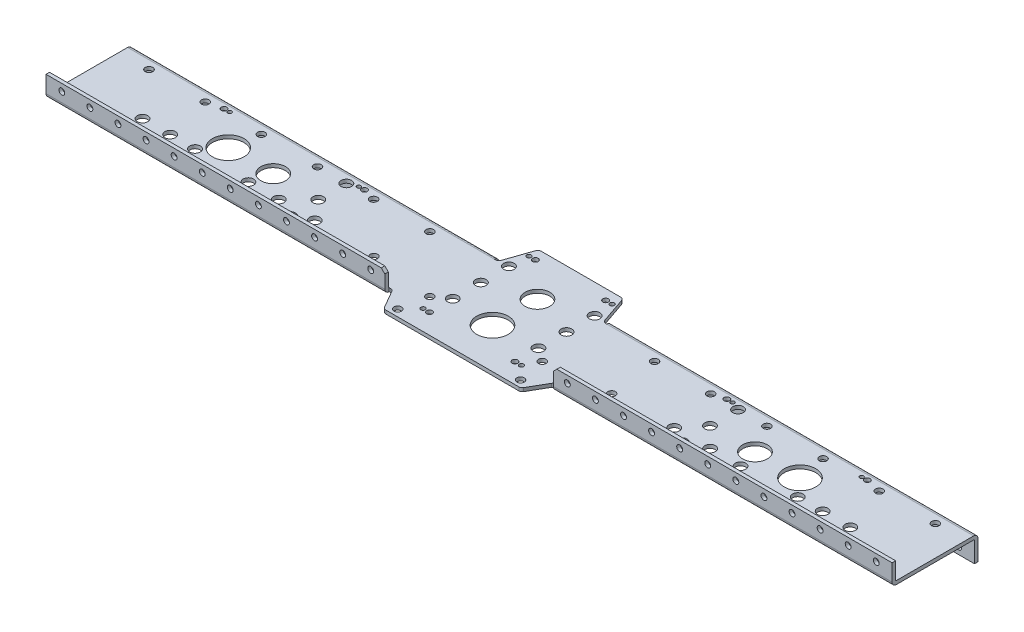
from build123d import *

# Parameters (mm, degrees)
SKETCH1_W                        = 355.6
SKETCH1_H                        = 77.724
BOSS_EXTRUDE1_DEPTH              = 22.225
SKETCH2_W                        = 74.549
SKETCH2_H                        = 19.05
CUT_EXTRUDE1_DEPTH               = 364.67400769
SKETCH3_W                        = 25.4
SKETCH3_H                        = 3.937
CUT_EXTRUDE2_DEPTH               = 817.364663535
SKETCH4_W                        = 330.2
SKETCH4_H                        = 3.175
BOSS_EXTRUDE2_DEPTH              = 15.875
SKETCH5_W                        = 69.85
SKETCH5_H                        = 3.175
BOSS_EXTRUDE3_DEPTH              = 457.2
SKETCH6_W                        = 330.2
SKETCH6_H                        = 3.175
BOSS_EXTRUDE4_DEPTH              = 3.937
SKETCH7_W                        = 330.2
SKETCH7_H                        = 3.175
BOSS_EXTRUDE5_DEPTH              = 15.875
SKETCH8_W                        = 355.6
SKETCH8_H                        = 3.175
BOSS_EXTRUDE6_DEPTH              = 3.937
SKETCH9_W                        = 355.6
SKETCH9_H                        = 3.175
BOSS_EXTRUDE7_DEPTH              = 19.05
SKETCH10_W                       = 124.052954744
SKETCH10_H                       = 3.175
BOSS_EXTRUDE8_DEPTH              = 19.05
SKETCH11_W                       = 76.358809824
SKETCH11_H                       = 3.175
BOSS_EXTRUDE9_DEPTH              = 27.432
DRAFT1_ANGLE                     = 30
DRAFT2_ANGLE                     = 19
F_6_CLEARANCE_HOLE1_D            = 4.064
F_6_CLEARANCE_HOLE1_DEPTH        = 19.05
HOLE1_D                          = 28.575
HOLE1_DEPTH                      = 19.05
F_7_8_0_875_DIAMETER_HOLE1_D     = 22.225
F_7_8_0_875_DIAMETER_HOLE1_DEPTH = 19.05
F_3_8_0_375_DIAMETER_HOLE1_D     = 9.525
F_3_8_0_375_DIAMETER_HOLE1_DEPTH = 19.05
F_5_CLEARANCE_HOLE1_D            = 3.571875
F_5_CLEARANCE_HOLE1_DEPTH        = 19.05
F_7_0_201_DIAMETER_HOLE1_D       = 5.1054
F_7_0_201_DIAMETER_HOLE1_DEPTH   = 19.05
H_0_266_DIAMETER_HOLE1_D         = 6.7564
H_0_266_DIAMETER_HOLE1_DEPTH     = 19.05
F_10_CLEARANCE_HOLE1_D           = 5.334
F_10_CLEARANCE_HOLE1_DEPTH       = 101.219
F_10_CLEARANCE_HOLE2_D           = 5.334
F_10_CLEARANCE_HOLE2_DEPTH       = 26.67
CHAMFER1_SIZE                    = 3.175
FILLET1_R                        = 0.762
FILLET2_R                        = 3.175
FILLET3_R                        = 3.937
CUT_EXTRUDE3_REACH               = 820.823
SKETCH30_W                       = 23.8125
SKETCH30_H                       = 77.724
CUT_EXTRUDE3_DIRECTION_2_REACH   = 820.823


with BuildPart() as part:
    # Sketch1 → Boss-Extrude1 (new body)
    with BuildSketch(Plane(origin=(0, 3.175, 0), x_dir=(1, 0, 0), z_dir=(0, 1, 0))):
        with Locations((635, 34.925)):
            Rectangle(SKETCH1_W, SKETCH1_H)
    extrude(amount=-BOSS_EXTRUDE1_DEPTH)

    # Sketch2 → Cut-Extrude1 (cut, through all)
    with BuildSketch(Plane(origin=(812.8, 0, 0), x_dir=(0, 0, -1), z_dir=(1, 0, 0))):
        with Locations((33.3375, -9.525)):
            Rectangle(SKETCH2_W, SKETCH2_H)
    extrude(amount=-CUT_EXTRUDE1_DEPTH, mode=Mode.SUBTRACT)

    # Sketch3 → Cut-Extrude2 (cut, through all)
    with BuildSketch(Plane.XZ):
        with Locations((469.9, 1.9685)):
            Rectangle(SKETCH3_W, SKETCH3_H)
    extrude(amount=-CUT_EXTRUDE2_DEPTH, mode=Mode.SUBTRACT)

    # Sketch4 → Boss-Extrude2 (add)
    with BuildSketch(Plane(origin=(0, 3.175, 0), x_dir=(-1, 0, 0), z_dir=(0, 1, 0))):
        with Locations((-647.7, 2.3495)):
            Rectangle(SKETCH4_W, SKETCH4_H)
    extrude(amount=BOSS_EXTRUDE2_DEPTH)

    # Sketch5 → Boss-Extrude3 (add)
    with BuildSketch(Plane.ZY.offset(-457.2)):
        with Locations((-34.925, 1.5875)):
            Rectangle(SKETCH5_W, SKETCH5_H)
    extrude(amount=BOSS_EXTRUDE3_DEPTH)

    # Sketch6 → Boss-Extrude4 (add)
    with BuildSketch(Plane.XY):
        with Locations((165.1, 1.5875)):
            Rectangle(SKETCH6_W, SKETCH6_H)
    extrude(amount=BOSS_EXTRUDE4_DEPTH)

    # Sketch7 → Boss-Extrude5 (add)
    with BuildSketch(Plane(origin=(0, 3.175, 0), x_dir=(-1, 0, 0), z_dir=(0, 1, 0))):
        with Locations((-165.1, 2.3495)):
            Rectangle(SKETCH7_W, SKETCH7_H)
    extrude(amount=BOSS_EXTRUDE5_DEPTH)

    # Sketch8 → Boss-Extrude6 (add)
    with BuildSketch(Plane(origin=(0, 0, -69.85), x_dir=(-1, 0, 0), z_dir=(0, 0, -1))):
        with Locations((-177.8, 1.5875)):
            Rectangle(SKETCH8_W, SKETCH8_H)
    extrude(amount=BOSS_EXTRUDE6_DEPTH)

    # Sketch9 → Boss-Extrude7 (add)
    with BuildSketch(Plane.XZ):
        with Locations((177.8, -72.1995)):
            Rectangle(SKETCH9_W, SKETCH9_H)
    extrude(amount=BOSS_EXTRUDE7_DEPTH)

    # Sketch10 → Boss-Extrude8 (add)
    with BuildSketch(Plane.XY):
        with Locations((406.4, 1.5875)):
            Rectangle(SKETCH10_W, SKETCH10_H)
    extrude(amount=BOSS_EXTRUDE8_DEPTH)

    # Sketch11 → Boss-Extrude9 (add)
    with BuildSketch(Plane(origin=(0, 0, -69.85), x_dir=(-1, 0, 0), z_dir=(0, 0, -1))):
        with Locations((-406.4, 1.5875)):
            Rectangle(SKETCH11_W, SKETCH11_H)
    extrude(amount=BOSS_EXTRUDE9_DEPTH)

    # Draft1
    draft1_faces = [part.faces().sort_by_distance(p)[0] for p in [
        (344.373522628, 1.5875, 9.525),
        (468.426477372, 1.5875, 9.525),
    ]]
    draft(draft1_faces, Plane.XY.offset(19.05), DRAFT1_ANGLE)

    # Draft2
    draft2_faces = [part.faces().sort_by_distance(p)[0] for p in [
        (368.220595088, 1.5875, -83.566),
        (444.579404912, 1.5875, -83.566),
    ]]
    draft(draft2_faces, Plane(origin=(0, 0, -97.282), x_dir=(-1, 0, 0), z_dir=(0, 0, -1)), DRAFT2_ANGLE)

    # #6 Clearance Hole1
    with Locations(Plane(origin=(0, 0, 0), x_dir=(-1, 0, 0), z_dir=(0, -1, 0))):
        with Locations((-450.8881, -1.03886), (-361.9119, -1.03886), (-368.808, 87.85352), (-443.992, 87.85352)):
            Hole(F_6_CLEARANCE_HOLE1_D / 2, depth=F_6_CLEARANCE_HOLE1_DEPTH)

    # Hole1
    with Locations(Plane(origin=(0, 0, 0), x_dir=(-1, 0, 0), z_dir=(0, -1, 0))):
        with Locations((-147.829162832, 36.83), (-406.4, 17.272), (-664.970837168, 36.83)):
            Hole(HOLE1_D / 2, depth=HOLE1_DEPTH)

    # 7/8 (0.875) Diameter Hole1
    with Locations(Plane(origin=(0, 0, 0), x_dir=(-1, 0, 0), z_dir=(0, -1, 0))):
        with Locations((-188.545362832, 36.83), (-406.4, 57.9628), (-624.254637168, 36.83)):
            Hole(F_7_8_0_875_DIAMETER_HOLE1_D / 2, depth=F_7_8_0_875_DIAMETER_HOLE1_DEPTH)

    # 3/8 (0.375) Diameter Hole1
    with Locations(Plane(origin=(0, 0, 0), x_dir=(-1, 0, 0), z_dir=(0, -1, 0))):
        with Locations((-229.261562832, 11.43), (-229.261562832, 62.23), (-229.261562832, 36.83), (-367.67570279, 70.866), (-367.67570279, 20.066), (-445.12429721, 20.066), (-445.12429721, 70.866), (-367.67570279, 45.466), (-445.12429721, 45.466), (-628.947697627, 19.05), (-601.438495912, 19.05), (-568.924874752, 19.05), (-243.875125248, 19.05), (-211.361504088, 19.05), (-183.852302373, 19.05), (-678.944202666, 20.828), (-701.450372003, 20.828), (-726.460886343, 20.828), (-133.855797334, 20.828), (-111.349627997, 20.828), (-86.339113657, 20.828), (-583.538437168, 62.23), (-583.538437168, 36.83), (-583.538437168, 11.43)):
            Hole(F_3_8_0_375_DIAMETER_HOLE1_D / 2, depth=F_3_8_0_375_DIAMETER_HOLE1_DEPTH)

    # #5 Clearance Hole1
    with Locations(Plane(origin=(0, 0, 0), x_dir=(-1, 0, 0), z_dir=(0, -1, 0))):
        with Locations((-237.440362832, 65.405), (-237.440362832, 8.255), (-120.600362832, 8.255), (-120.600362832, 65.405), (-575.359637168, 65.405), (-575.359637168, 8.255), (-692.199637168, 65.405), (-692.199637168, 8.255)):
            Hole(F_5_CLEARANCE_HOLE1_D / 2, depth=F_5_CLEARANCE_HOLE1_DEPTH)

    # #7 (0.201) Diameter Hole1
    with Locations(Plane(origin=(0, 0, 0), x_dir=(-1, 0, 0), z_dir=(0, -1, 0))):
        with Locations((-242.520362832, 65.405), (-242.520362832, 8.255), (-115.520362832, 8.255), (-115.520362832, 65.405), (-367.7539, -1.03886), (-445.0461, -1.03886), (-374.65, 87.85352), (-438.15, 87.85352), (-570.279637168, 65.405), (-570.279637168, 8.255), (-697.279637168, 65.405), (-697.279637168, 8.255)):
            Hole(F_7_0_201_DIAMETER_HOLE1_D / 2, depth=F_7_0_201_DIAMETER_HOLE1_DEPTH)

    # H (0.266) Diameter Hole1
    with Locations(Plane(origin=(0, 0, 0), x_dir=(-1, 0, 0), z_dir=(0, -1, 0))):
        with Locations((-508, 62.23), (-558.8, 11.43), (-558.8, 62.23), (-609.6, 11.43), (-457.2, 11.43), (-355.6, 11.43), (-304.8, 62.23), (-254, 62.23), (-152.4, 11.43), (-101.6, 62.23), (-101.6, 11.43), (-50.8, 62.23), (-254, 11.43), (-203.2, 62.23), (-203.2, 11.43), (-152.4, 62.23), (-711.2, 62.23), (-762, 11.43), (-762, 62.23), (-609.6, 62.23), (-660.4, 11.43), (-660.4, 62.23), (-711.2, 11.43), (-50.8, 11.43), (-461.9625, -12.8905), (-350.8375, -12.8905), (-513.925467617, 17.547282407), (-298.874532383, 17.547282407)):
            Hole(H_0_266_DIAMETER_HOLE1_D / 2, depth=H_0_266_DIAMETER_HOLE1_DEPTH)

    # #10 Clearance Hole1
    with Locations(Plane.XY.offset(3.937)):
        with Locations((495.3, 12.7), (520.7, 12.7), (546.1, 12.7), (571.5, 12.7), (596.9, 12.7), (622.3, 12.7), (647.7, 12.7), (673.1, 12.7), (698.5, 12.7), (723.9, 12.7), (749.3, 12.7), (774.7, 12.7), (800.1, 12.7), (317.5, 12.7), (292.1, 12.7), (266.7, 12.7), (241.3, 12.7), (215.9, 12.7), (190.5, 12.7), (165.1, 12.7), (139.7, 12.7), (114.3, 12.7), (88.9, 12.7), (63.5, 12.7), (12.7, 12.7), (38.1, 12.7)):
            Hole(F_10_CLEARANCE_HOLE1_D / 2, depth=F_10_CLEARANCE_HOLE1_DEPTH)

    # #10 Clearance Hole2
    with Locations(Plane.XY.offset(-70.612)):
        with Locations((469.9, -12.7), (495.3, -12.7), (520.7, -12.7), (546.1, -12.7), (571.5, -12.7), (596.9, -12.7), (622.3, -12.7), (647.7, -12.7), (673.1, -12.7), (698.5, -12.7), (723.9, -12.7), (749.3, -12.7), (774.7, -12.7), (800.1, -12.7), (342.9, -12.7), (317.5, -12.7), (292.1, -12.7), (266.7, -12.7), (241.3, -12.7), (215.9, -12.7), (190.5, -12.7), (165.1, -12.7), (139.7, -12.7), (114.3, -12.7), (88.9, -12.7), (63.5, -12.7), (38.1, -12.7), (12.7, -12.7)):
            Hole(F_10_CLEARANCE_HOLE2_D / 2, depth=F_10_CLEARANCE_HOLE2_DEPTH)

    # Chamfer1
    chamfer1_edges = [part.edges().sort_by_distance(p)[0] for p in [
        (0, -19.05, -72.1995),
        (355.6, -19.05, -72.1995),
        (812.8, -19.05, -72.1995),
        (812.8, 19.05, 2.3495),
        (482.6, 19.05, 2.3495),
        (457.2, -19.05, -72.1995),
        (330.2, 19.05, 2.3495),
        (0, 19.05, 2.3495),
    ]]
    chamfer(chamfer1_edges, length=CHAMFER1_SIZE)

    # Fillet1
    fillet1_edges = [part.edges().sort_by_distance(p)[0] for p in [
        (635, 0, -70.612),
        (165.1, 3.175, 0.762),
        (647.7, 3.175, 0.762),
        (177.8, 0, -70.612),
    ]]
    fillet(fillet1_edges, radius=FILLET1_R)

    # Fillet2
    fillet2_edges = [part.edges().sort_by_distance(p)[0] for p in [
        (333.375, 1.5875, 0),
        (479.425, 1.5875, 0),
        (344.373522628, 1.5875, 19.05),
        (468.426477372, 1.5875, 19.05),
        (454.025, 1.5875, -69.85),
        (358.775, 1.5875, -69.85),
        (444.579404912, 1.5875, -97.282),
        (368.220595088, 1.5875, -97.282),
    ]]
    fillet(fillet2_edges, radius=FILLET2_R)

    # Fillet3
    fillet3_edges = [part.edges().sort_by_distance(p)[0] for p in [
        (177.8, 3.175, -73.787),
        (165.1, 0, 3.937),
        (647.7, 0, 3.937),
        (635, 3.175, -73.787),
    ]]
    fillet(fillet3_edges, radius=FILLET3_R)

    # Sketch30 → Cut-Extrude3 (cut, up to next)
    with BuildSketch(Plane(origin=(0, 0, 0), x_dir=(-1, 0, 0), z_dir=(0, -1, 0)), mode=Mode.PRIVATE) as cut_extrude3_sk1:
        with Locations((-800.89375, 34.925)):
            Rectangle(SKETCH30_W, SKETCH30_H)
    cut_extrude3_tool1 = extrude(cut_extrude3_sk1.sketch, amount=-CUT_EXTRUDE3_REACH, mode=Mode.PRIVATE) & part.part
    # Sketch30 → Cut-Extrude3 (cut, up to next)
    with BuildSketch(Plane(origin=(0, 0, 0), x_dir=(-1, 0, 0), z_dir=(0, -1, 0)), mode=Mode.PRIVATE) as cut_extrude3_sk2:
        with Locations((-11.90625, 34.925)):
            Rectangle(SKETCH30_W, SKETCH30_H)
    cut_extrude3_tool2 = extrude(cut_extrude3_sk2.sketch, amount=-CUT_EXTRUDE3_REACH, mode=Mode.PRIVATE) & part.part
    add(cut_extrude3_tool1.solids().sort_by_distance((800.89375, 0, -34.925))[0], mode=Mode.SUBTRACT)
    add(cut_extrude3_tool2.solids().sort_by_distance((11.90625, 0, -34.925))[0], mode=Mode.SUBTRACT)

    # Sketch30 → Cut-Extrude3 direction 2 (cut, up to next)
    with BuildSketch(Plane(origin=(0, 0, 0), x_dir=(-1, 0, 0), z_dir=(0, -1, 0)), mode=Mode.PRIVATE) as cut_extrude3_direction_2_sk1:
        with Locations((-800.89375, 34.925)):
            Rectangle(SKETCH30_W, SKETCH30_H)
    cut_extrude3_direction_2_tool1 = extrude(cut_extrude3_direction_2_sk1.sketch, amount=CUT_EXTRUDE3_DIRECTION_2_REACH, mode=Mode.PRIVATE) & part.part
    # Sketch30 → Cut-Extrude3 direction 2 (cut, up to next)
    with BuildSketch(Plane(origin=(0, 0, 0), x_dir=(-1, 0, 0), z_dir=(0, -1, 0)), mode=Mode.PRIVATE) as cut_extrude3_direction_2_sk2:
        with Locations((-11.90625, 34.925)):
            Rectangle(SKETCH30_W, SKETCH30_H)
    cut_extrude3_direction_2_tool2 = extrude(cut_extrude3_direction_2_sk2.sketch, amount=CUT_EXTRUDE3_DIRECTION_2_REACH, mode=Mode.PRIVATE) & part.part
    add(cut_extrude3_direction_2_tool1.solids().sort_by_distance((800.89375, 0, -34.925))[0], mode=Mode.SUBTRACT)
    add(cut_extrude3_direction_2_tool2.solids().sort_by_distance((11.90625, 0, -34.925))[0], mode=Mode.SUBTRACT)


solid = part.part
